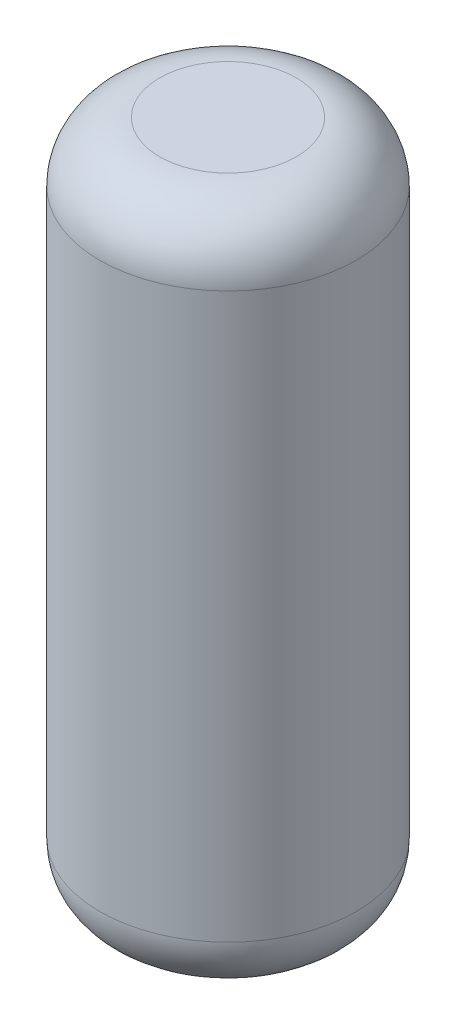
from build123d import *


with BuildPart() as part:
    # Sketch1 → Revolve1 (revolve)
    with BuildSketch(Plane.XY, mode=Mode.PRIVATE) as revolve1_sk:
        with BuildLine():
            Line((0, 3616.128942787), (-400, 3616.128942787))
            ThreePointArc((-400, 3616.128942787), (-647.487373415, 3513.616316202), (-750, 3266.128942787))
            Line((-750, 3266.128942787), (-750, -33.871057213))
            ThreePointArc((-750, -33.871057213), (-647.487373415, -281.358430629), (-400, -383.871057213))
            Line((-400, -383.871057213), (0, -383.871057213))
            Line((0, -383.871057213), (0, -283.871057213))
            Line((0, -283.871057213), (-50, -283.871057213))
            ThreePointArc((-50, -283.871057213), (-297.487373415, -181.358430629), (-400, 66.128942787))
            Line((-400, 66.128942787), (-400, 3166.128942787))
            ThreePointArc((-400, 3166.128942787), (-297.487373415, 3413.616316202), (-50, 3516.128942787))
            Line((-50, 3516.128942787), (0, 3516.128942787))
            Line((0, 3516.128942787), (0, 3616.128942787))
        make_face()
    revolve(revolve1_sk.sketch.rotate(Axis((0, 0, 0), (0, 1, 0)), 270), axis=Axis((0, 0, 0), (0, 1, 0)))


solid = part.part
